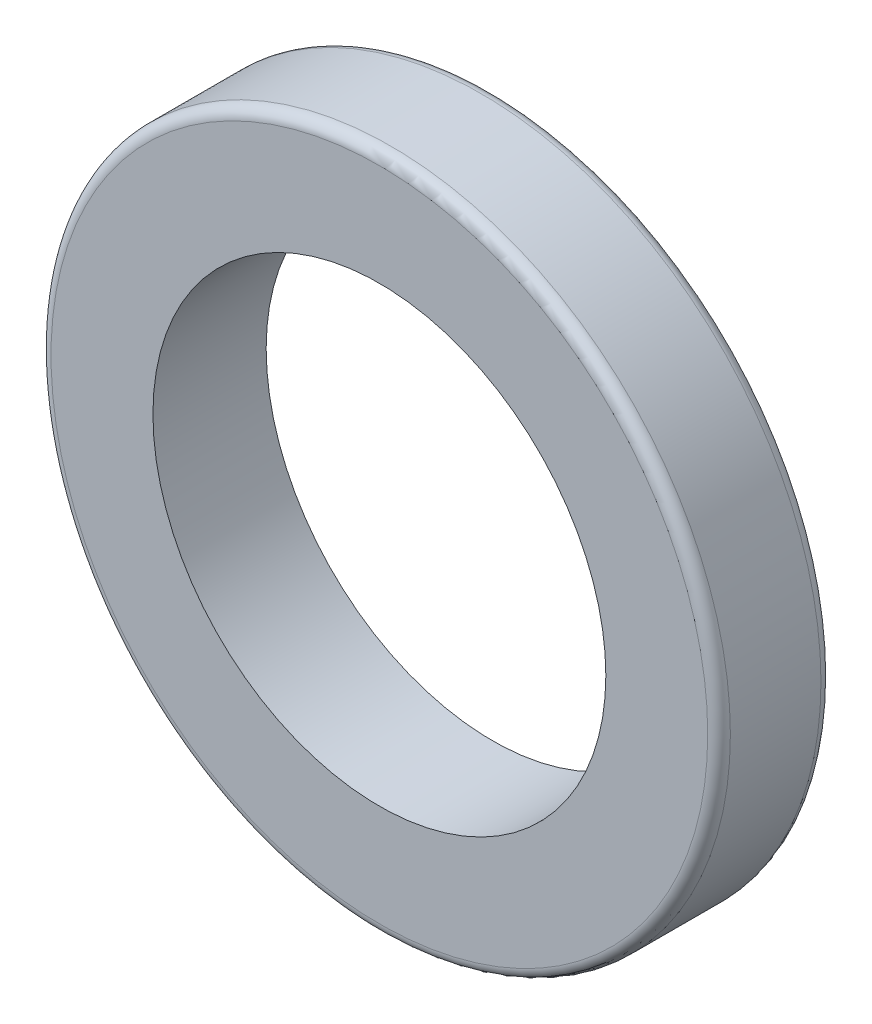
from build123d import *

# Parameters (mm, degrees)
SKETCH1_R           = 7.62
SKETCH1_R_2         = 5.08
BOSS_EXTRUDE1_DEPTH = 2.54
FILLET1_R           = 0.254


with BuildPart() as part:
    # Sketch1 → Boss-Extrude1 (new body)
    with BuildSketch(Plane.XY):
        Circle(SKETCH1_R)
        Circle(SKETCH1_R_2, mode=Mode.SUBTRACT)
    extrude(amount=BOSS_EXTRUDE1_DEPTH)

    # Fillet1
    fillet1_edges = [part.edges().sort_by_distance(p)[0] for p in [
        (-7.62, 0, 0),
        (-7.62, 0, 2.54),
    ]]
    fillet(fillet1_edges, radius=FILLET1_R)


solid = part.part
